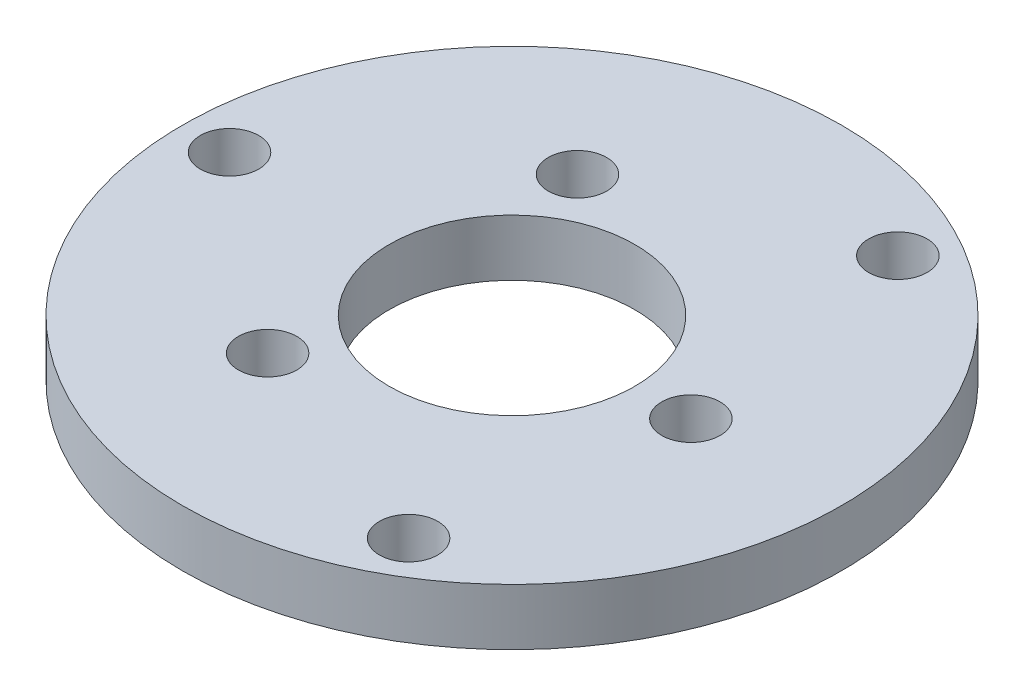
from build123d import *

# Parameters (mm, degrees)
SKETCH_1_R      = 17.5
SKETCH_1_R_2    = 6.525
SKETCH_1_R_3    = 1.55
EXTRUDE_1_DEPTH = 3


with BuildPart() as part:
    # 草图1 → 凸台-拉伸1 (new body)
    with BuildSketch(Plane(origin=(0, 0, 0), x_dir=(1, 0, 0), z_dir=(0, 1, 0))):
        with Locations(Location((0, 0, 0), (0, 0, 270))):
            Circle(SKETCH_1_R)
        with Locations(Location((0, 0, 0), (0, 0, 270))):
            Circle(SKETCH_1_R_2, mode=Mode.SUBTRACT)
        with Locations(Location((-15, 0, 0), (0, 0, 270))):
            Circle(SKETCH_1_R_3, mode=Mode.SUBTRACT)
        with Locations(Location((7.5, 12.990381057, 0), (0, 0, 270))):
            Circle(SKETCH_1_R_3, mode=Mode.SUBTRACT)
        with Locations(Location((7.5, -12.990381057, 0), (0, 0, 270))):
            Circle(SKETCH_1_R_3, mode=Mode.SUBTRACT)
        with Locations(Location((9.5, 0, 0), (0, 0, 270))):
            Circle(SKETCH_1_R_3, mode=Mode.SUBTRACT)
        with Locations(Location((-4.75, -8.227241336, 0), (0, 0, 270))):
            Circle(SKETCH_1_R_3, mode=Mode.SUBTRACT)
        with Locations(Location((-4.75, 8.227241336, 0), (0, 0, 270))):
            Circle(SKETCH_1_R_3, mode=Mode.SUBTRACT)
    extrude(amount=EXTRUDE_1_DEPTH)


solid = part.part
